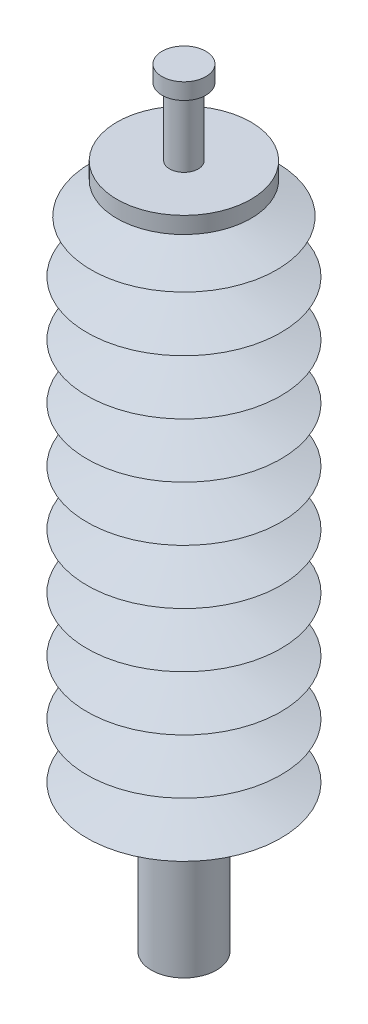
from build123d import *


with BuildPart() as part:
    # Croquis1 → Revolución1 (revolve)
    with BuildSketch(Plane.XY, mode=Mode.PRIVATE) as revoluci_n1_sk:
        Polygon((0, 0), (0, 1000), (0, 1050.939325751), (0, 1179.596825217), (33.678420865, 1179.596825217), (33.678420865, 1154.729022207), (21.987750201, 1154.729022207), (21.987750201, 1050.939325751), (102.820969977, 1050.939325751), (102.820969977, 1025.469662875), (50, 1025.469662875), (50, 1000), (142.43669746, 976.989967783), (50, 921.400938378), (148.786291167, 896.810317934), (50, 837.402807764), (148.786291167, 812.812187319), (50, 753.404677149), (148.786291167, 728.814056705), (50, 669.406546534), (148.786291167, 644.81592609), (50, 585.40841592), (148.786291167, 560.817795475), (50, 501.410285305), (148.786291167, 476.819664861), (50, 417.41215469), (148.786291167, 392.821534246), (50, 333.414024076), (148.786291167, 308.823403631), (50, 249.415893461), (148.786291167, 224.825273017), (50, 165.417762846), (50, 0), align=None)
    revolve(revoluci_n1_sk.sketch.rotate(Axis((0, 0, 0), (0, 1, 0)), 90), axis=Axis((0, 0, 0), (0, 1, 0)))


solid = part.part
